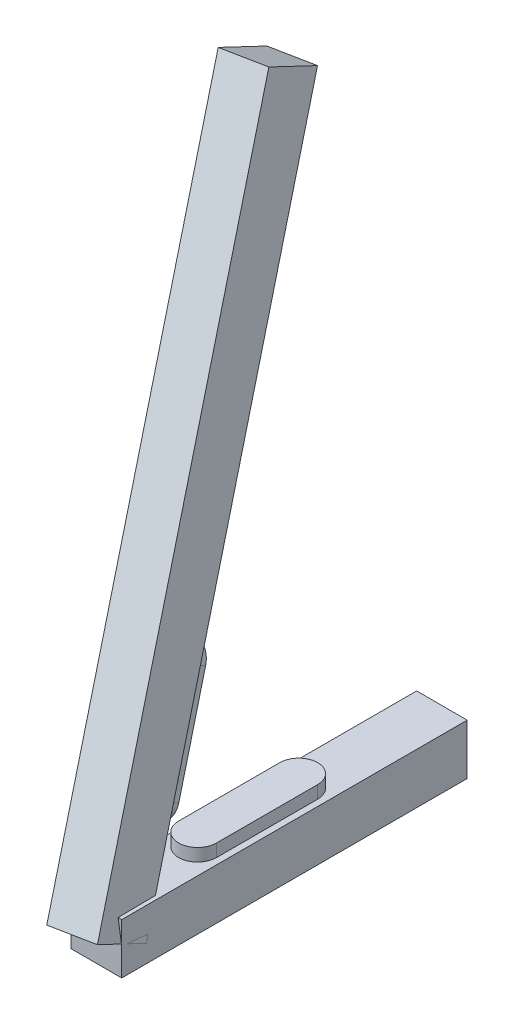
from build123d import *

# Parameters (mm, degrees)
SKETCH1_W           = 25.4
SKETCH1_H           = 25.4
BOSS_EXTRUDE1_DEPTH = 173.513484
BOSS_EXTRUDE2_DEPTH = 324.147601
BOSS_EXTRUDE3_DEPTH = 6.35
BOSS_EXTRUDE4_DEPTH = 6.35


with BuildPart() as part:
    # Sketch1 → Boss-Extrude1 (new body)
    with BuildSketch(Plane.XY):
        Rectangle(SKETCH1_W, SKETCH1_H)
    extrude(amount=-BOSS_EXTRUDE1_DEPTH)


with BuildPart() as body_2:
    # Sketch2 → Boss-Extrude2 (new body)
    with BuildSketch(Plane(origin=(0, 0, 0), x_dir=(0.9833973165172839, 0.08431330932106285, -0.16068909028909165), z_dir=(-0.1441814720332392, 0.9007248773125119, -0.40976383260689164))):
        Polygon((-14.585880515, -10.480080611), (10.480080611, -14.585880515), (14.585880515, 10.480080611), (-10.480080611, 14.585880515), align=None)
    extrude(amount=BOSS_EXTRUDE2_DEPTH)


with BuildPart() as body_3:
    # Sketch3 → Boss-Extrude3 (new body)
    with BuildSketch(Plane(origin=(0.637830783, -5.167580224, -11.583578312), x_dir=(0.9987379660310203, 0.020798404327615726, 0.045715441435535804), z_dir=(-0.050222896296522594, 0.40689608064106725, 0.9120927805034567))):
        with BuildLine():
            Line((-24.055967576, 99.169531858), (-16.740848632, 48.898973528))
            ThreePointArc((-16.740848632, 48.898973528), (-5.943534143, 40.844828643), (2.110610742, 51.642143132))
            Line((2.110610742, 51.642143132), (-5.204508203, 101.912701462))
            ThreePointArc((-5.204508203, 101.912701462), (-16.001822692, 109.966846347), (-24.055967576, 99.169531858))
        make_face()
    extrude(amount=-BOSS_EXTRUDE3_DEPTH)


with BuildPart() as body_4:
    # Sketch4 → Boss-Extrude4 (new body)
    with BuildSketch(Plane(origin=(0, 12.7, 0), x_dir=(-1, 0, 0), z_dir=(0, -1, 0))):
        with BuildLine():
            Line((-9.525, 101.6), (-9.525, 50.8))
            ThreePointArc((-9.525, 50.8), (0, 41.275), (9.525, 50.8))
            Line((9.525, 50.8), (9.525, 101.6))
            ThreePointArc((9.525, 101.6), (0, 111.125), (-9.525, 101.6))
        make_face()
    extrude(amount=-BOSS_EXTRUDE4_DEPTH)


solid = Compound([part.part, body_2.part, body_3.part, body_4.part])
